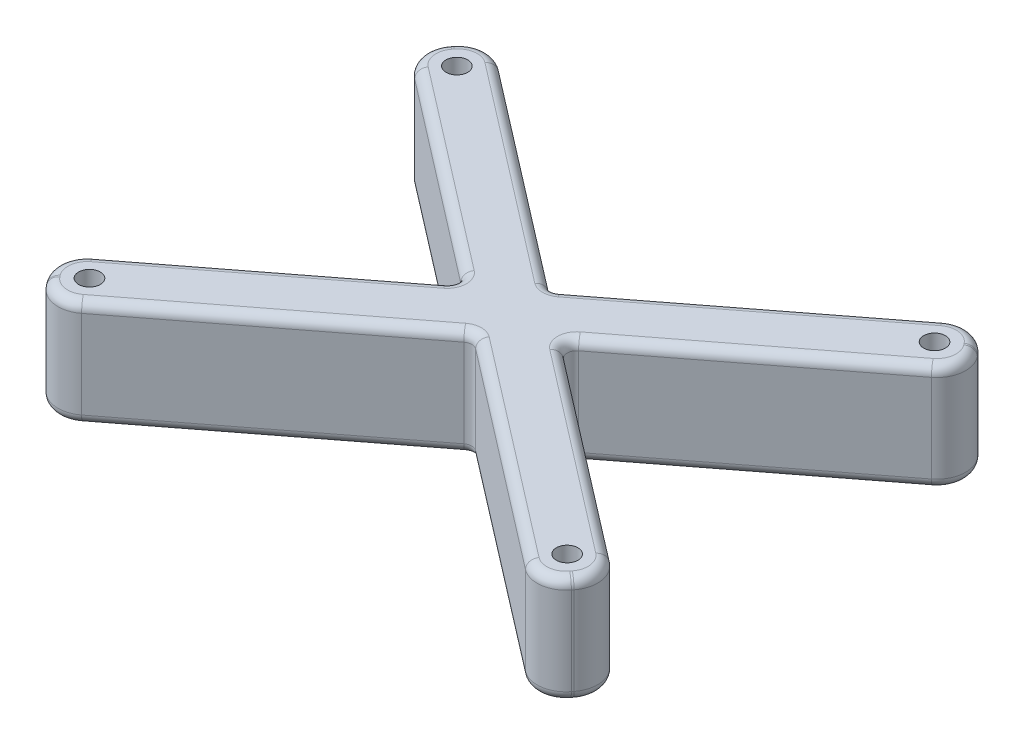
from build123d import *

# Parameters (mm, degrees)
SKETCH1_R           = 2.25
BOSS_EXTRUDE1_DEPTH = 22.2504
FILLET1_R           = 6
FILLET2_R           = 2
FILLET4_R           = 2


with BuildPart() as part:
    # Sketch1 → Boss-Extrude1 (new body)
    with BuildSketch(Plane(origin=(0, 0, 0), x_dir=(1, 0, 0), z_dir=(0, 1, 0))):
        Polygon((-50.784418919, 46.884029766), (-58.341905742, 37.059296897), (-10.164819777, 0), (-58.341905742, -37.059296897), (-50.784418919, -46.884029766), (0, -7.819092136), (50.784418919, -46.884029766), (58.341905742, -37.059296897), (10.164819777, 0), (58.341905742, 37.059296897), (50.784418919, 46.884029766), (0, 7.819092136), align=None)
        with Locations(Location((-49.53, 38.1, 0), (0, 0, 90))):
            Circle(SKETCH1_R, mode=Mode.SUBTRACT)
        with Locations(Location((-49.53, -38.1, 0), (0, 0, 90))):
            Circle(SKETCH1_R, mode=Mode.SUBTRACT)
        with Locations(Location((49.53, -38.1, 0), (0, 0, 90))):
            Circle(SKETCH1_R, mode=Mode.SUBTRACT)
        with Locations(Location((49.53, 38.1, 0), (0, 0, 90))):
            Circle(SKETCH1_R, mode=Mode.SUBTRACT)
    extrude(amount=BOSS_EXTRUDE1_DEPTH)

    # Fillet1
    fillet1_edges = [part.edges().sort_by_distance(p)[0] for p in [
        (50.784418919, 11.1252, -46.884029766),
        (58.341905742, 11.1252, -37.059296897),
        (58.341905742, 11.1252, 37.059296897),
        (50.784418919, 11.1252, 46.884029766),
        (-50.784418919, 11.1252, 46.884029766),
        (-58.341905742, 11.1252, 37.059296897),
        (-58.341905742, 11.1252, -37.059296897),
        (-50.784418919, 11.1252, -46.884029766),
    ]]
    fillet(fillet1_edges, radius=FILLET1_R)

    # Fillet2
    fillet2_edges = [part.edges().sort_by_distance(p)[0] for p in [
        (0, 11.1252, -7.819092136),
        (10.164819777, 11.1252, 0),
        (0, 11.1252, 7.819092136),
        (-10.164819777, 11.1252, 0),
    ]]
    fillet(fillet2_edges, radius=FILLET2_R)

    # Fillet4
    fillet4_edges = [part.edges().sort_by_distance(p)[0] for p in [
        (32.905901978, 0, -17.493140155),
        (32.905901978, 22.2504, -17.493140155),
        (-23.624048253, 0, -25.991436946),
        (-23.624048253, 22.2504, -25.991436946),
        (-32.905901978, 0, 17.493140155),
        (-32.905901978, 22.2504, 17.493140155),
        (23.624048253, 0, 25.991436946),
        (23.624048253, 22.2504, 25.991436946),
        (11.44506367, 0, 0),
        (11.44506367, 22.2504, 0),
        (0, 0, -8.342356669),
        (0, 22.2504, -8.342356669),
        (-11.44506367, 0, 0),
        (-11.44506367, 22.2504, 0),
        (0, 0, 8.342356669),
        (0, 22.2504, 8.342356669),
        (23.624048253, 0, -25.991436946),
        (23.624048253, 22.2504, -25.991436946),
        (54.563162331, 0, -41.971663331),
        (32.905901978, 0, 17.493140155),
        (54.563162331, 0, 41.971663331),
        (-23.624048253, 0, 25.991436946),
        (-54.563162331, 0, 41.971663331),
        (-32.905901978, 0, -17.493140155),
        (-54.563162331, 0, -41.971663331),
        (-55.87749971, 0, -37.380741162),
        (-50.462974654, 0, -44.419623734),
        (-55.87749971, 0, 37.380741162),
        (-50.462974654, 0, 44.419623734),
        (50.462974654, 0, 44.419623734),
        (55.87749971, 0, 37.380741162),
        (55.87749971, 0, -37.380741162),
        (50.462974654, 0, -44.419623734),
        (54.563162331, 22.2504, -41.971663331),
        (-54.563162331, 22.2504, -41.971663331),
        (-32.905901978, 22.2504, -17.493140155),
        (-54.563162331, 22.2504, 41.971663331),
        (-23.624048253, 22.2504, 25.991436946),
        (54.563162331, 22.2504, 41.971663331),
        (32.905901978, 22.2504, 17.493140155),
        (-55.87749971, 22.2504, -37.380741162),
        (-50.462974654, 22.2504, -44.419623734),
        (-55.87749971, 22.2504, 37.380741162),
        (-50.462974654, 22.2504, 44.419623734),
        (50.462974654, 22.2504, 44.419623734),
        (55.87749971, 22.2504, 37.380741162),
        (55.87749971, 22.2504, -37.380741162),
        (50.462974654, 22.2504, -44.419623734),
    ]]
    fillet(fillet4_edges, radius=FILLET4_R)


solid = part.part
